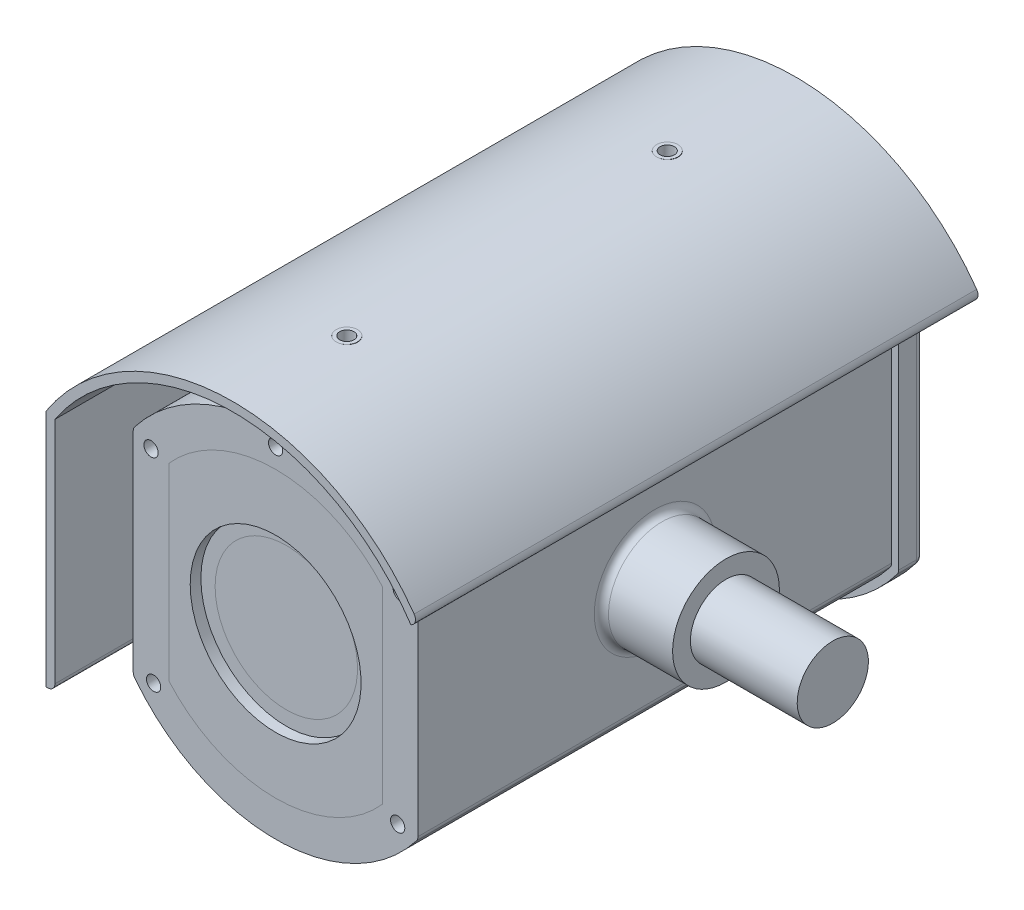
from build123d import *

# Parameters (mm, degrees)
BOSS_EXTRUDE1_DEPTH      = 140
CUT_EXTRUDE1_DEPTH       = 7
BOSS_EXTRUDE2_DEPTH      = 12
BOSS_EXTRUDE2_DEPTH_BACK = 146
SKETCH4_R                = 24
SKETCH4_R_2              = 20
BOSS_EXTRUDE3_DEPTH      = 4
CUT_EXTRUDE2_START       = -7
SKETCH5_R                = 20
CUT_EXTRUDE2_DEPTH       = 7
SKETCH6_R                = 11
CUT_EXTRUDE3_DEPTH       = 1
DOME1_FACE_RADIUS        = 11
DOME1_HEIGHT             = 5
SKETCH7_R                = 3
BOSS_EXTRUDE4_DEPTH      = 12.5
SKETCH8_R                = 2
CUT_EXTRUDE4_DEPTH       = 17
BOSS_EXTRUDE5_REACH      = 198.256
BOSS_EXTRUDE5_END_RADIUS = 50
SKETCH9_R                = 3
SKETCH10_R               = 2
CUT_EXTRUDE5_DEPTH       = 17
BOSS_EXTRUDE6_DEPTH      = 7
SKETCH12_W               = 70
SKETCH12_H               = 3.5
CUT_EXTRUDE6_DEPTH       = 5
SKETCH14_R               = 20
BOSS_EXTRUDE7_DEPTH      = 2
SKETCH15_R               = 24
BOSS_EXTRUDE8_DEPTH      = 5
SKETCH16_R               = 2
CUT_EXTRUDE8_DEPTH       = 5
CUT_EXTRUDE7_DEPTH       = 303.977741111
CUT_EXTRUDE7_DEPTH_BACK  = 303.977741111
SKETCH13_R               = 124.287084565
SKETCH17_R               = 10
BOSS_EXTRUDE9_DEPTH      = 50
SKETCH18_R               = 15
SKETCH18_R_2             = 10
BOSS_EXTRUDE10_DEPTH     = 20
FILLET1_R                = 2


with BuildPart() as part:
    # Sketch1 → Boss-Extrude1 (new body)
    with BuildSketch(Plane.XY):
        with BuildLine():
            Line((-40, -30), (-40, 30))
            ThreePointArc((-40, 30), (0, 50), (40, 30))
            Line((40, 30), (40, -30))
            ThreePointArc((40, -30), (0, -50), (-40, -30))
        make_face()
    extrude(amount=BOSS_EXTRUDE1_DEPTH)

    # Sketch2 → Cut-Extrude1 (cut)
    with BuildSketch(Plane.XY.offset(140)):
        with BuildLine():
            Line((-30, 26.457513111), (-30, -26.457513111))
            ThreePointArc((-30, -26.457513111), (0, -40), (30, -26.457513111))
            Line((30, -26.457513111), (30, 26.457513111))
            ThreePointArc((30, 26.457513111), (0, 40), (-30, 26.457513111))
        make_face()
    extrude(amount=-CUT_EXTRUDE1_DEPTH, mode=Mode.SUBTRACT)

    # Sketch4 → Boss-Extrude3 (add)
    with BuildSketch(Plane.XY.offset(133)):
        Circle(SKETCH4_R)
        Circle(SKETCH4_R_2, mode=Mode.SUBTRACT)
    extrude(amount=BOSS_EXTRUDE3_DEPTH)

    # Sketch5 → Cut-Extrude2 (cut)
    with BuildSketch(Plane.XY.offset(133).offset(CUT_EXTRUDE2_START)):
        Circle(SKETCH5_R)
    extrude(amount=CUT_EXTRUDE2_DEPTH, mode=Mode.SUBTRACT)

    # Sketch6 → Cut-Extrude3 (cut)
    with BuildSketch(Plane.XY.offset(126)):
        Circle(SKETCH6_R)
    extrude(amount=-CUT_EXTRUDE3_DEPTH, mode=Mode.SUBTRACT)

    # Dome1: a dome of height H over a round flat face of radius A is a cap of a sphere of radius (A * A + H * H) / (2 * H)
    dome1_r = (DOME1_FACE_RADIUS * DOME1_FACE_RADIUS + DOME1_HEIGHT * DOME1_HEIGHT) / (2 * DOME1_HEIGHT)
    dome1_base = Plane((0, 0, 125), z_dir=(0, 0, 1))
    with Locations(dome1_base.offset(DOME1_HEIGHT - dome1_r)):
        dome1_ball = Sphere(dome1_r, mode=Mode.PRIVATE)
    add(split(dome1_ball, bisect_by=dome1_base, keep=Keep.TOP, mode=Mode.PRIVATE))



with BuildPart() as body_2:
    # Sketch3 → Boss-Extrude2 (new, two sides: drawn at the far end of the back side and taken through both)
    with BuildSketch(Plane.XY.offset(140).offset(-BOSS_EXTRUDE2_DEPTH_BACK)):
        with BuildLine():
            Line((52.5, -33.166247904), (52.5, 33.911649916))
            ThreePointArc((52.5, 33.911649916), (0.380386371, 62.498842439), (-52.083333333, 34.5481749))
            Line((-52.083333333, 34.5481749), (-50, 33.166247904))
            ThreePointArc((-50, 33.166247904), (0, 60), (50, 33.166247904))
            Line((50, 33.166247904), (50, -33.166247904))
            Line((50, -33.166247904), (52.5, -33.166247904))
        make_face()
    extrude(amount=BOSS_EXTRUDE2_DEPTH + BOSS_EXTRUDE2_DEPTH_BACK)


with BuildPart() as part_1:
    add(part.part)

    add(body_2.part)  # Boss-Extrude4 merges body 2
    # Sketch7 → Boss-Extrude4 (add)
    with BuildSketch(Plane(origin=(52.5, 0, 0), x_dir=(0, 0, -1), z_dir=(1, 0, 0))):
        with Locations(Location((-120, 0, 0), (0, 0, 270))):
            Circle(SKETCH7_R)
        with Locations(Location((-30, 0, 0), (0, 0, 270))):
            Circle(SKETCH7_R)
    extrude(amount=-BOSS_EXTRUDE4_DEPTH)

    # Sketch8 → Cut-Extrude4 (cut)
    with BuildSketch(Plane(origin=(52.5, 0, 0), x_dir=(0, 0, -1), z_dir=(1, 0, 0))):
        with Locations((-120, 0)):
            Circle(SKETCH8_R)
        with Locations((-30, 0)):
            Circle(SKETCH8_R)
    extrude(amount=-CUT_EXTRUDE4_DEPTH, mode=Mode.SUBTRACT)

    # Boss-Extrude5: up to this cylinder (the profile starts outside it)
    boss_extrude5_end = Plane(origin=(0, 0, 75), z_dir=(0, 0, -1)) * Cylinder(BOSS_EXTRUDE5_END_RADIUS, 587.512, mode=Mode.PRIVATE)
    # Sketch9 → Boss-Extrude5 (add, up to the surface)
    with BuildSketch(Plane(origin=(0, 62.5, 0), x_dir=(-1, 0, 0), z_dir=(0, 1, 0)), mode=Mode.PRIVATE) as boss_extrude5_sk1:
        with Locations(Location((0, 120, 0), (0, 0, 90))):
            Circle(SKETCH9_R)
    boss_extrude5_tool1 = extrude(boss_extrude5_sk1.sketch, amount=-BOSS_EXTRUDE5_REACH, mode=Mode.PRIVATE) - boss_extrude5_end
    add(boss_extrude5_tool1.solids().sort_by_distance((0, 62.5, 120))[0])
    # Sketch9 → Boss-Extrude5 (add, up to the surface)
    with BuildSketch(Plane(origin=(0, 62.5, 0), x_dir=(-1, 0, 0), z_dir=(0, 1, 0)), mode=Mode.PRIVATE) as boss_extrude5_sk2:
        with Locations(Location((0, 30, 0), (0, 0, 90))):
            Circle(SKETCH9_R)
    boss_extrude5_tool2 = extrude(boss_extrude5_sk2.sketch, amount=-BOSS_EXTRUDE5_REACH, mode=Mode.PRIVATE) - boss_extrude5_end
    add(boss_extrude5_tool2.solids().sort_by_distance((0, 62.5, 30))[0])

    # Sketch10 → Cut-Extrude5 (cut)
    with BuildSketch(Plane(origin=(0, 62.5, 0), x_dir=(1, 0, 0), z_dir=(0, 1, 0))):
        with Locations(Location((0, -30, 0), (0, 0, 270))):
            Circle(SKETCH10_R)
        with Locations(Location((0, -120, 0), (0, 0, 270))):
            Circle(SKETCH10_R)
    extrude(amount=-CUT_EXTRUDE5_DEPTH, mode=Mode.SUBTRACT)

    # Sketch11 → Boss-Extrude6 (add)
    with BuildSketch(Plane(origin=(0, 0, 0), x_dir=(-1, 0, 0), z_dir=(0, 0, -1))):
        with BuildLine():
            Line((-42, 30.659419434), (-42, -30.659419434))
            ThreePointArc((-42, -30.659419434), (0, -52), (42, -30.659419434))
            Line((42, -30.659419434), (42, 30.659419434))
            ThreePointArc((42, 30.659419434), (0, 52), (-42, 30.659419434))
        make_face()
        with BuildLine():
            Line((-40, 30), (-40, -30))
            ThreePointArc((-40, -30), (0, -50), (40, -30))
            Line((40, -30), (40, 30))
            ThreePointArc((40, 30), (0, 50), (-40, 30))
        make_face(mode=Mode.SUBTRACT)
    extrude(amount=-BOSS_EXTRUDE6_DEPTH)

    # Sketch12 → Cut-Extrude6 (cut)
    with BuildSketch(Plane(origin=(0, 0, 0), x_dir=(-1, 0, 0), z_dir=(0, 0, -1))):
        with BuildLine():
            ThreePointArc((16.155494421, 42), (0, 45), (-16.155494421, 42))
            Line((-16.155494421, 42), (16.155494421, 42))
        make_face()
        with BuildLine():
            ThreePointArc((-21.558061137, 39.5), (-24.342017693, 37.84793488), (-27, 36))
            Line((-27, 36), (27, 36))
            ThreePointArc((27, 36), (24.342017693, 37.84793488), (21.558061137, 39.5))
            Line((21.558061137, 39.5), (-21.558061137, 39.5))
        make_face()
        with BuildLine():
            ThreePointArc((-30.045798375, 33.5), (-31.841535092, 31.798060365), (-33.541019662, 30))
            Line((-33.541019662, 30), (33.541019662, 30))
            ThreePointArc((33.541019662, 30), (31.841535092, 31.798060365), (30.045798375, 33.5))
            Line((30.045798375, 33.5), (-30.045798375, 33.5))
        make_face()
        with Locations((0, 25.75)):
            Rectangle(SKETCH12_W, SKETCH12_H)
        with Locations((0, 19.75)):
            Rectangle(SKETCH12_W, SKETCH12_H)
        with Locations((0, 13.75)):
            Rectangle(SKETCH12_W, SKETCH12_H)
        with Locations((0, 7.75)):
            Rectangle(SKETCH12_W, SKETCH12_H)
        with Locations((0, 1.75)):
            Rectangle(SKETCH12_W, SKETCH12_H)
        with Locations((0, -4.25)):
            Rectangle(SKETCH12_W, SKETCH12_H)
        with Locations((0, -10.25)):
            Rectangle(SKETCH12_W, SKETCH12_H)
        with Locations((0, -16.25)):
            Rectangle(SKETCH12_W, SKETCH12_H)
        with Locations((0, -22.25)):
            Rectangle(SKETCH12_W, SKETCH12_H)
        with BuildLine():
            Line((35, -26.5), (-35, -26.5))
            Line((-35, -26.5), (-35, -28.284271247))
            ThreePointArc((-35, -28.284271247), (-34.281245243, -29.151264546), (-33.541019662, -30))
            Line((-33.541019662, -30), (33.541019662, -30))
            ThreePointArc((33.541019662, -30), (34.281245243, -29.151264546), (35, -28.284271247))
            Line((35, -28.284271247), (35, -26.5))
        make_face()
        with BuildLine():
            Line((31.124748995, -32.5), (-31.124748995, -32.5))
            ThreePointArc((-31.124748995, -32.5), (-29.115015223, -34.31203708), (-27, -36))
            Line((-27, -36), (27, -36))
            ThreePointArc((27, -36), (29.115015223, -34.31203708), (31.124748995, -32.5))
        make_face()
        with BuildLine():
            Line((23.296995514, -38.5), (-23.296995514, -38.5))
            ThreePointArc((-23.296995514, -38.5), (-19.803717846, -40.408077899), (-16.155494421, -42))
            Line((-16.155494421, -42), (16.155494421, -42))
            ThreePointArc((16.155494421, -42), (19.803717846, -40.408077899), (23.296995514, -38.5))
        make_face()
    extrude(amount=-CUT_EXTRUDE6_DEPTH, mode=Mode.SUBTRACT)

    # Sketch16 → Cut-Extrude8 (cut)
    with BuildSketch(Plane.XY.offset(140)):
        with Locations((35, 27.5)):
            Circle(SKETCH16_R)
        with Locations((-35, 27.5)):
            Circle(SKETCH16_R)
        with Locations((0, 45.5)):
            Circle(SKETCH16_R)
        with Locations((34.281245243, -29.151264546)):
            Circle(SKETCH16_R)
        with Locations((-34.281245243, -29.151264546)):
            Circle(SKETCH16_R)
    extrude(amount=-CUT_EXTRUDE8_DEPTH, mode=Mode.SUBTRACT)


with BuildPart() as body_2_2:
    # Sketch14 → Boss-Extrude7 (new body)
    with BuildSketch(Plane.XY.offset(137)):
        Circle(SKETCH14_R)
    extrude(amount=-BOSS_EXTRUDE7_DEPTH)


with BuildPart() as body_3:
    # Sketch15 → Boss-Extrude8 (new body)
    with BuildSketch(Plane.XY.offset(140)):
        with BuildLine():
            Line((-30, 26.457513111), (-30, -26.457513111))
            ThreePointArc((-30, -26.457513111), (0, -40), (30, -26.457513111))
            Line((30, -26.457513111), (30, 26.457513111))
            ThreePointArc((30, 26.457513111), (0, 40), (-30, 26.457513111))
        make_face()
        Circle(SKETCH15_R, mode=Mode.SUBTRACT)
    extrude(amount=-BOSS_EXTRUDE8_DEPTH)


with BuildPart() as body_4:
    # Mirror2: mirrored copy
    add(body_3.part.mirror(Plane(origin=(-101.014745231, 0, 0), x_dir=(0, 0, 1), z_dir=(1, 0, 0))))


with BuildPart() as body_5:
    # Mirror2 2: mirrored copy
    add(body_2_2.part.mirror(Plane(origin=(-101.014745231, 0, 0), x_dir=(0, 0, 1), z_dir=(1, 0, 0))))


with BuildPart() as body_6:
    # Mirror2 3: mirrored copy
    add(part_1.part.mirror(Plane(origin=(-101.014745231, 0, 0), x_dir=(0, 0, 1), z_dir=(1, 0, 0))))

    # Sketch17 → Boss-Extrude9 (add)
    with BuildSketch(Plane(origin=(-162.029490461, 0, 0), x_dir=(0, 0, -1), z_dir=(1, 0, 0))):
        with Locations(Location((-73.5, 0, 0), (0, 0, 270))):
            Circle(SKETCH17_R)
    extrude(amount=BOSS_EXTRUDE9_DEPTH)

    # Sketch18 → Boss-Extrude10 (add)
    with BuildSketch(Plane(origin=(-162.029490461, 0, 0), x_dir=(0, 0, -1), z_dir=(1, 0, 0))):
        with Locations(Location((-73.5, 0, 0), (0, 0, 270))):
            Circle(SKETCH18_R)
        with Locations(Location((-73.5, 0, 0), (0, 0, 90))):
            Circle(SKETCH18_R_2, mode=Mode.SUBTRACT)
    extrude(amount=BOSS_EXTRUDE10_DEPTH)

    # Fillet1
    fillet1_edges = [body_6.edges().sort_by_distance(p)[0] for p in [
        (-244.029490461, 30.659419434, 3.5),
        (-160.029490461, 30.659419434, 3.5),
        (-160.029490461, -30.659419434, 3.5),
        (-244.029490461, -30.659419434, 3.5),
        (-252.029490461, -33.166247904, 73),
        (-202.029490461, 52, 0),
        (-244.029490461, 0, 0),
        (-202.029490461, -52, 0),
        (-160.029490461, 0, 0),
        (-149.946157128, 34.5481749, 73),
        (-252.029490461, 3, 120),
        (-242.029490461, 3, 120),
        (-242.029490461, 30, 73.5),
        (-162.029490461, 30, 73.5),
        (-162.029490461, -30, 73.5),
        (-242.029490461, -30, 73.5),
        (-162.029490461, 15, 73.5),
        (-252.029490461, 3, 30),
        (-242.029490461, 3, 30),
        (-202.029490459, 60.000000006, 117.000000018),
        (-202.029490459, 50.000000007, 117.000000018),
        (-202.029490461, 59.999999997, 26.999999988),
        (-202.029490461, 49.999999997, 26.999999988),
    ]]
    fillet(fillet1_edges, radius=FILLET1_R)


with BuildPart() as cut_extrude7_tool:
    # Sketch13 → Cut-Extrude7 (new, two sides: drawn at the far end of the back side and taken through both)
    with BuildSketch(Plane.XY.offset(-CUT_EXTRUDE7_DEPTH_BACK)):
        Circle(SKETCH13_R)
    extrude(amount=CUT_EXTRUDE7_DEPTH + CUT_EXTRUDE7_DEPTH_BACK)


with BuildPart() as part_2:
    add(part_1.part)

    # Cut-Extrude7: cut by cut_extrude7_tool
    add(cut_extrude7_tool.part, mode=Mode.SUBTRACT)


with BuildPart() as body_2_2_1:
    add(body_2_2.part)

    # Cut-Extrude7: cut by cut_extrude7_tool
    add(cut_extrude7_tool.part, mode=Mode.SUBTRACT)


with BuildPart() as body_3_1:
    add(body_3.part)

    # Cut-Extrude7: cut by cut_extrude7_tool
    add(cut_extrude7_tool.part, mode=Mode.SUBTRACT)


solid = Compound([body_4.part, body_5.part, body_6.part])
